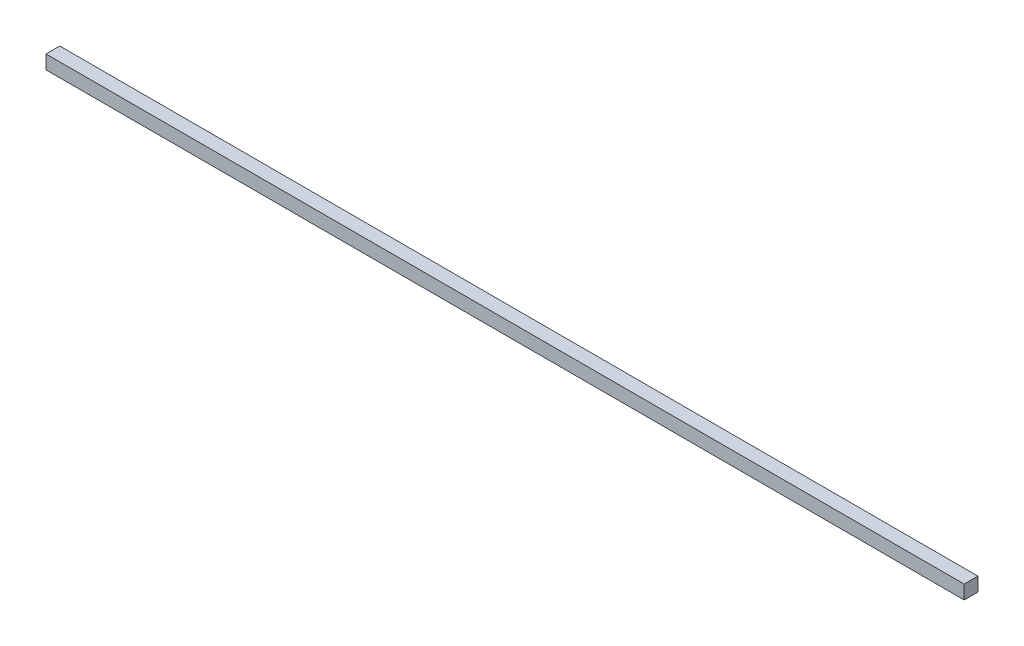
from build123d import *

# Parameters (mm, degrees)
SKETCH1_W           = 100
SKETCH1_H           = 1.5
BOSS_EXTRUDE1_DEPTH = 1.5
SCALE1_SCALE        = 10


with BuildPart() as part:
    # Sketch1 → Boss-Extrude1 (new body)
    with BuildSketch(Plane.XY):
        with Locations((50, 0.75)):
            Rectangle(SKETCH1_W, SKETCH1_H)
    extrude(amount=BOSS_EXTRUDE1_DEPTH)


with BuildPart() as part_1:
    # Scale1: scaled about (0, 0, 0)
    add(part.part.scale(SCALE1_SCALE))


solid = part_1.part
